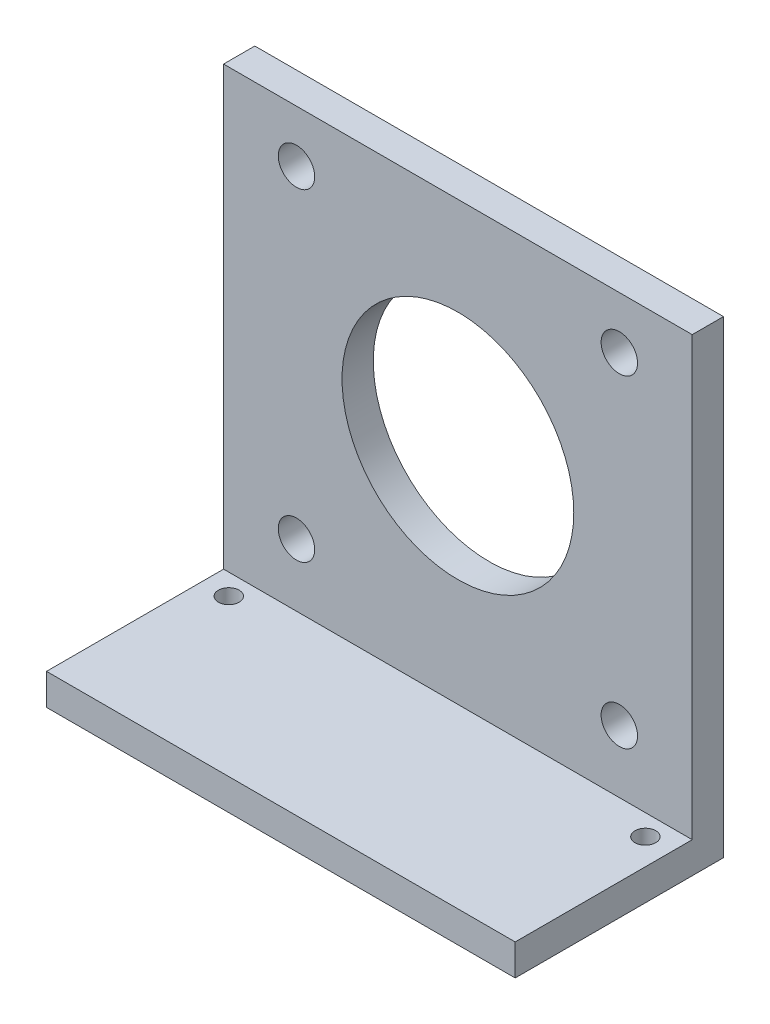
from build123d import *

# Parameters (mm, degrees)
ESQUISSE1_W        = 45
ESQUISSE1_H        = 42
ESQUISSE1_R        = 1.75
ESQUISSE1_R_2      = 11.125
BOSS_EXTRU_1_DEPTH = 3
ESQUISSE3_W        = 45
ESQUISSE3_H        = 20
ESQUISSE3_R        = 1
BOSS_EXTRU_2_DEPTH = 3


with BuildPart() as part:
    # Esquisse1 → Boss.-Extru.1 (new body)
    with BuildSketch(Plane.XY):
        with Locations((15.5, 15)):
            Rectangle(ESQUISSE1_W, ESQUISSE1_H)
        with Locations((0, 31)):
            Circle(ESQUISSE1_R, mode=Mode.SUBTRACT)
        with Locations((31, 31)):
            Circle(ESQUISSE1_R, mode=Mode.SUBTRACT)
        with Locations((31, 0)):
            Circle(ESQUISSE1_R, mode=Mode.SUBTRACT)
        Circle(ESQUISSE1_R, mode=Mode.SUBTRACT)
        with Locations((15.5, 15.5)):
            Circle(ESQUISSE1_R_2, mode=Mode.SUBTRACT)
    extrude(amount=BOSS_EXTRU_1_DEPTH)

    # Esquisse3 → Boss.-Extru.2 (add)
    with BuildSketch(Plane.XZ.offset(6)):
        with Locations((15.5, 10)):
            Rectangle(ESQUISSE3_W, ESQUISSE3_H)
        with Locations((-4.5, 5)):
            Circle(ESQUISSE3_R, mode=Mode.SUBTRACT)
        with Locations(Location((35.5, 5, 0), (0, 0, 180))):
            Circle(ESQUISSE3_R, mode=Mode.SUBTRACT)
    extrude(amount=BOSS_EXTRU_2_DEPTH)


solid = part.part
